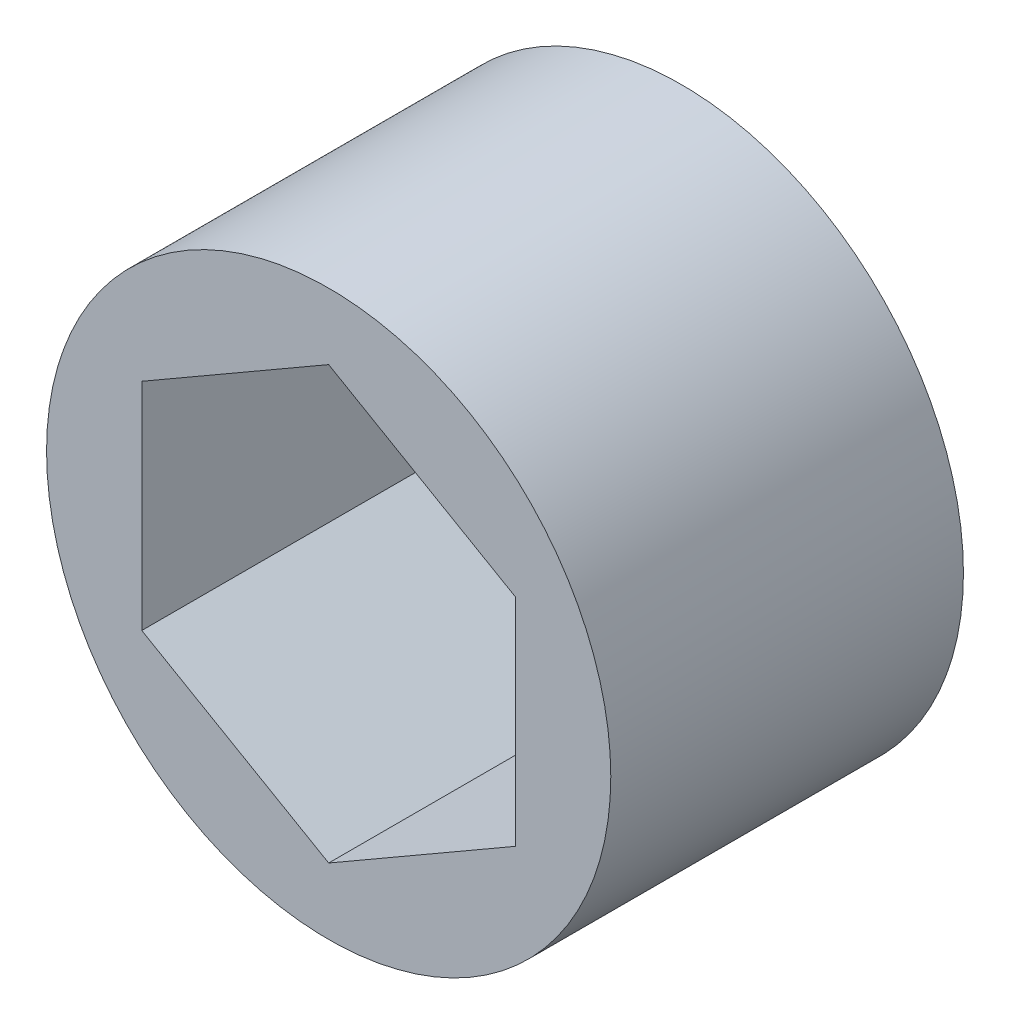
from build123d import *

# Parameters (mm, degrees)
SKETCH1_R           = 10.16
BOSS_EXTRUDE1_DEPTH = 6.35


with BuildPart() as part:
    # Sketch1 → Boss-Extrude1 (new, symmetric)
    with BuildSketch(Plane.XY):
        Circle(SKETCH1_R)
        Polygon((0, 7.772289324), (-6.731, 3.886144662), (-6.731, -3.886144662), (0, -7.772289324), (6.731, -3.886144662), (6.731, 3.886144662), align=None, mode=Mode.SUBTRACT)
    extrude(amount=BOSS_EXTRUDE1_DEPTH, both=True)


solid = part.part
